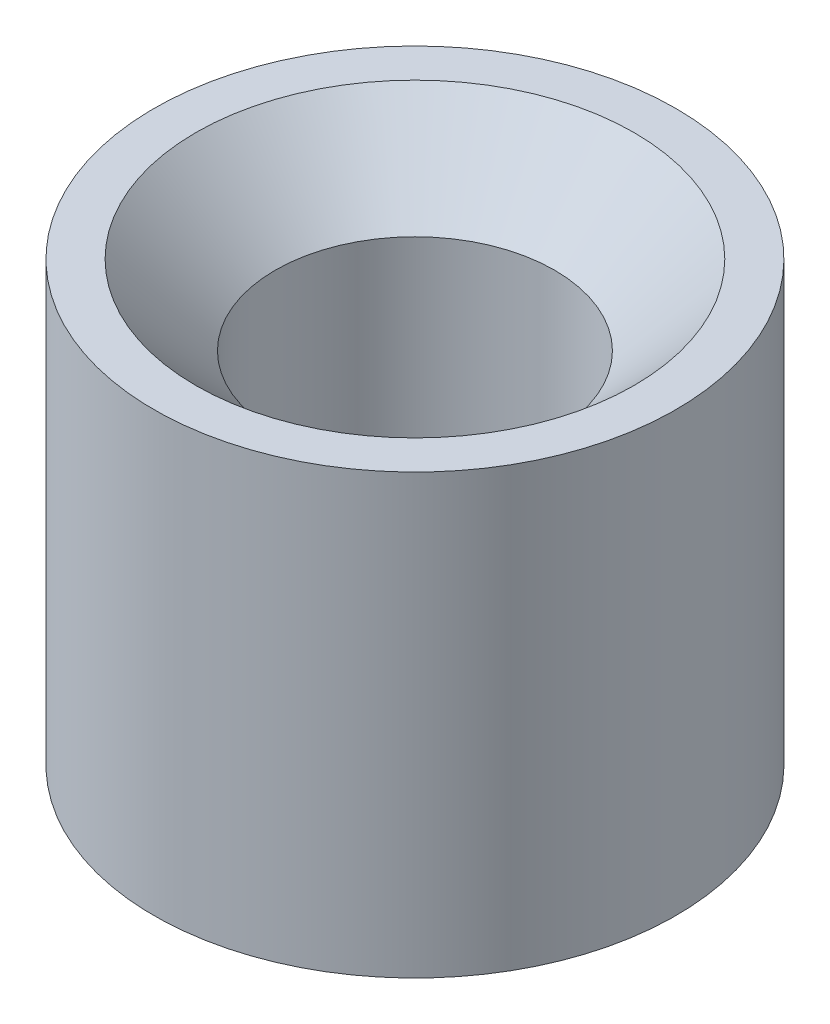
from build123d import *


with BuildPart() as part:
    # 草图1 → 旋转1 (revolve)
    with BuildSketch(Plane.XY, mode=Mode.PRIVATE) as revolve_1_sk:
        Polygon((3.12, 0), (3.12, 5.24), (2.62, 5.24), (1.67, 4.29), (1.67, 0.95), (2.62, 0), align=None)
    revolve(revolve_1_sk.sketch.rotate(Axis((0, 0, 0), (0, 1, 0)), 90), axis=Axis((0, 0, 0), (0, 1, 0)))


solid = part.part
